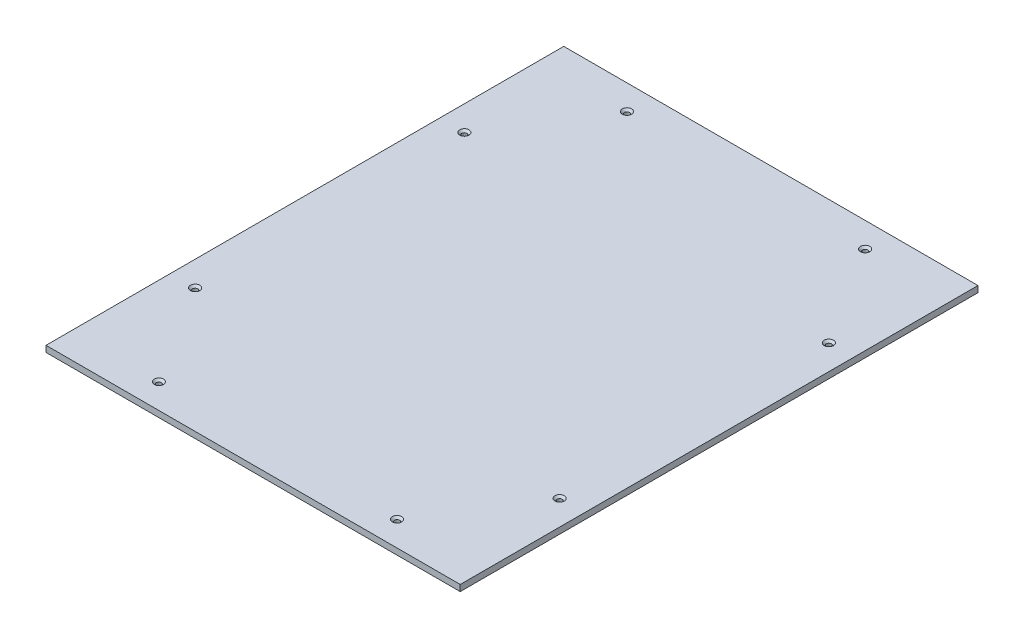
from build123d import *

# Parameters (mm, degrees)
ESQUISSE1_W             = 400
ESQUISSE1_H             = 500
BOSS_EXTRU_1_DEPTH      = 6
ESQUISSE2_R             = 2.5
ENL_V_MAT_EXTRU_1_DEPTH = 321.21242949
CHANFREIN1_SIZE         = 2


with BuildPart() as part:
    # Esquisse1 → Boss.-Extru.1 (new body)
    with BuildSketch(Plane(origin=(0, 0, 0), x_dir=(1, 0, 0), z_dir=(0, 1, 0))):
        Rectangle(ESQUISSE1_W, ESQUISSE1_H)
    extrude(amount=BOSS_EXTRU_1_DEPTH)

    # Esquisse2 → Enlèv. mat.-Extru.1 (cut, through all)
    with BuildSketch(Plane(origin=(0, 6, 0), x_dir=(1, 0, 0), z_dir=(0, 1, 0))):
        with Locations(Location((-176, 130, 0), (0, 0, 270))):
            Circle(ESQUISSE2_R)
        with Locations(Location((176, 130, 0), (0, 0, 270))):
            Circle(ESQUISSE2_R)
        with Locations(Location((-176, -130, 0), (0, 0, 270))):
            Circle(ESQUISSE2_R)
        with Locations(Location((176, -130, 0), (0, 0, 270))):
            Circle(ESQUISSE2_R)
        with Locations(Location((-115, 226, 0), (0, 0, 270))):
            Circle(ESQUISSE2_R)
        with Locations(Location((115, 226, 0), (0, 0, 270))):
            Circle(ESQUISSE2_R)
        with Locations(Location((-115, -226, 0), (0, 0, 270))):
            Circle(ESQUISSE2_R)
        with Locations(Location((115, -226, 0), (0, 0, 270))):
            Circle(ESQUISSE2_R)
    extrude(amount=-ENL_V_MAT_EXTRU_1_DEPTH, mode=Mode.SUBTRACT)

    # Chanfrein1
    chanfrein1_edges = [part.edges().sort_by_distance(p)[0] for p in [
        (-115, 6, -228.5),
        (176, 6, 127.5),
        (-176, 6, 127.5),
        (176, 6, -132.5),
        (115, 6, 223.5),
        (-115, 6, 223.5),
        (115, 6, -228.5),
        (-176, 6, -132.5),
    ]]
    chamfer(chanfrein1_edges, length=CHANFREIN1_SIZE)


solid = part.part
